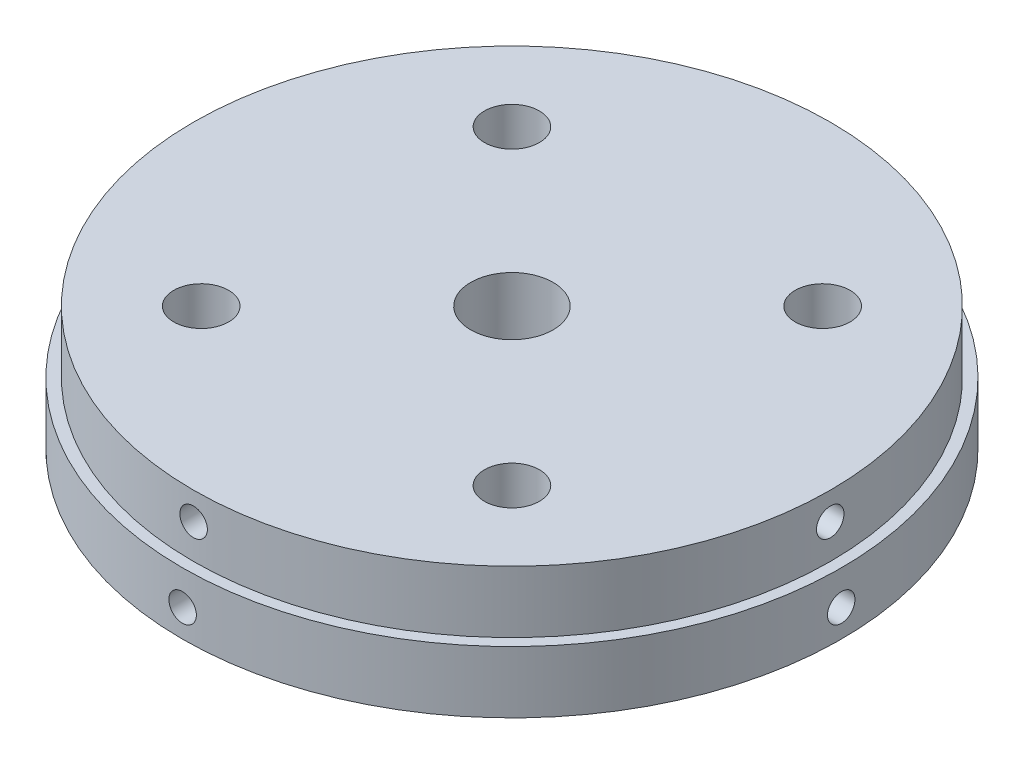
from build123d import *

# Parameters (mm, degrees)
SKETCH1_R           = 76.2
BOSS_EXTRUDE1_DEPTH = 28.575
SKETCH2_R           = 9.525
CUT_EXTRUDE1_DEPTH  = 112.48726665
SKETCH30_R          = 3.175
CUT_EXTRUDE2_DEPTH  = 25.4
CIRPATTERN3_COUNT   = 4
SKETCH31_R          = 6.35
CUT_EXTRUDE3_DEPTH  = 112.487266812
CIRPATTERN4_COUNT   = 4
SKETCH34_W          = 2.54
SKETCH34_H          = 14.2875


with BuildPart() as part:
    # Sketch1 → Boss-Extrude1 (new body)
    with BuildSketch(Plane(origin=(0, 0, 0), x_dir=(1, 0, 0), z_dir=(0, 1, 0))):
        with Locations(Location((0, 0, 0), (0, 0, 270))):
            Circle(SKETCH1_R)
    extrude(amount=BOSS_EXTRUDE1_DEPTH)

    # Sketch2 → Cut-Extrude1 (cut, through all)
    with BuildSketch(Plane(origin=(0, 28.575, 0), x_dir=(1, 0, 0), z_dir=(0, 1, 0))):
        with Locations(Location((0, 0, 0), (0, 0, 270))):
            Circle(SKETCH2_R)
    extrude(amount=-CUT_EXTRUDE1_DEPTH, mode=Mode.SUBTRACT)

    # Sketch30 → Cut-Extrude2 (cut)
    with BuildSketch(Plane.XY.offset(76.2)):
        with Locations((0, 22.225)):
            Circle(SKETCH30_R)
        with Locations((0, 6.35)):
            Circle(SKETCH30_R)
    cut_extrude2 = extrude(amount=-CUT_EXTRUDE2_DEPTH, mode=Mode.SUBTRACT)

    # CirPattern3: Cut-Extrude2 ×4 about axis
    cirpattern3_axis = Axis((0, 0, 0), (0, 1, 0))
    for i in range(1, CIRPATTERN3_COUNT):
        add(cut_extrude2.rotate(cirpattern3_axis, i * 360 / CIRPATTERN3_COUNT), mode=Mode.SUBTRACT)

    # Sketch31 → Cut-Extrude3 (cut, through all)
    with BuildSketch(Plane(origin=(0, 28.575, 0), x_dir=(1, 0, 0), z_dir=(0, 1, 0))):
        with Locations(Location((35.921024484, 35.921024484, 0), (0, 0, 270))):
            Circle(SKETCH31_R)
    cut_extrude3 = extrude(amount=-CUT_EXTRUDE3_DEPTH, mode=Mode.SUBTRACT)

    # CirPattern4: Cut-Extrude3 ×4 about axis
    cirpattern4_axis = Axis((0, 0, 0), (0, 1, 0))
    for i in range(1, CIRPATTERN4_COUNT):
        add(cut_extrude3.rotate(cirpattern4_axis, i * 360 / CIRPATTERN4_COUNT), mode=Mode.SUBTRACT)

    # Sketch34 → Cut-Revolve1 (revolve, cut)
    with BuildSketch(Plane.XY, mode=Mode.PRIVATE) as cut_revolve1_sk:
        with Locations((74.93, 21.43125)):
            Rectangle(SKETCH34_W, SKETCH34_H)
    revolve(cut_revolve1_sk.sketch.rotate(Axis((0, 28.575, 0), (0, -1, 0)), 90), axis=Axis((0, 28.575, 0), (0, -1, 0)), mode=Mode.SUBTRACT)


solid = part.part
